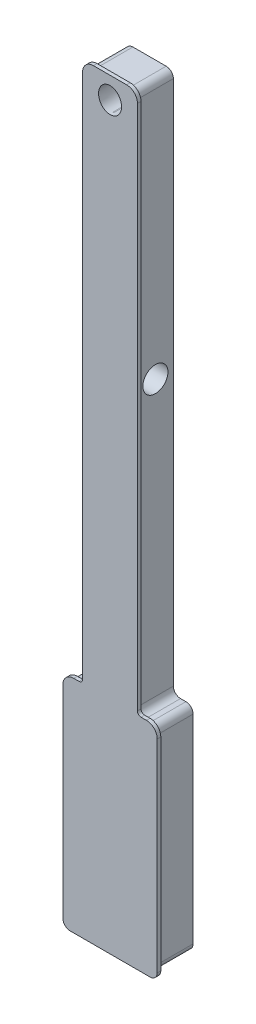
from build123d import *
from build123d.topology import SkipClean

# Parameters (mm, degrees)
BOSS_EXTRU_1_DEPTH       = 10
ESQUISSE2_RX             = 3.5
ESQUISSE2_RY             = 3
ENL_V_MAT_EXTRU_1_DEPTH  = 10
ESQUISSE3_R              = 3.2
ENL_V_MAT_EXTRU_2_DEPTH  = 10
ESQUISSE4_R              = 3.5
ENL_V_MAT_EXTRU_3_DEPTH  = 30
ESQUISSE5_W              = 26.27
ESQUISSE5_H              = 212
BOSS_EXTRU_2_DEPTH       = 1
CONG_1_R                 = 2
ENL_V_MAT_EXTRU_4_DEPTH  = 1
CONG_4_R                 = 2
ENL_V_START              = -15
ESQUISSE10_R             = 3.2
ENL_V_MAT_EXTRU_9_DEPTH  = 15
ESQUISSE11_RX            = 3.499824303
ESQUISSE11_RY            = 3.2
ENL_V_MAT_EXTRU_10_DEPTH = 15


with BuildPart() as part:
    # Esquisse1 → Boss.-Extru.1 (new body)
    with BuildSketch(Plane.XY):
        Polygon((-28.747990112, 301.570444422), (-28.747990112, 373.570444422), (-15.477990112, 373.570444422), (-15.477990112, 301.570444422), (-15.477990112, 223.567147766), (-15.477990112, 223.004578109), (-9.977990112, 223.004578109), (-9.977990112, 163.570444422), (-34.247990112, 163.570444422), (-34.247990112, 223.004578109), (-28.747990112, 223.004578109), align=None)
    extrude(amount=BOSS_EXTRU_1_DEPTH)

    # Esquisse2 → Enlèv. mat.-Extru.1 (cut)
    with BuildSketch(Plane.XY.offset(10)):
        with Locations(Location((-22.112990112, 368.570444422), (0, 0, 90))):
            Ellipse(ESQUISSE2_RX, ESQUISSE2_RY)
    extrude(amount=-ENL_V_MAT_EXTRU_1_DEPTH, mode=Mode.SUBTRACT)

    # Esquisse3 → Enlèv. mat.-Extru.2 (cut)
    with BuildSketch(Plane.XY.offset(10)):
        with Locations((-22.112990112, 368.570444422)):
            Circle(ESQUISSE3_R)
    extrude(amount=-ENL_V_MAT_EXTRU_2_DEPTH, mode=Mode.SUBTRACT)

    # Esquisse4 → Enlèv. mat.-Extru.3 (cut)
    with BuildSketch(Plane(origin=(-15.477990112, 0, 0), x_dir=(0, 0, -1), z_dir=(1, 0, 0))):
        with Locations((-5, 301.570444422)):
            Circle(ESQUISSE4_R)
    extrude(amount=-ENL_V_MAT_EXTRU_3_DEPTH, mode=Mode.SUBTRACT)

    # Esquisse5 → Boss.-Extru.2 (add)
    with BuildSketch(Plane.XY.offset(10)):
        with Locations((-22.112990112, 268.570444422)):
            Rectangle(ESQUISSE5_W, ESQUISSE5_H)
    extrude(amount=BOSS_EXTRU_2_DEPTH)

    # Congé1
    cong_1_edges = [part.edges().sort_by_distance(p)[0] for p in [
        (-15.477990112, 223.004578109, 5),
        (-15.477990112, 373.570444422, 5),
        (-28.747990112, 373.570444422, 5),
        (-28.747990112, 223.004578109, 5),
        (-34.247990112, 223.004578109, 5),
        (-34.247990112, 163.570444422, 5),
        (-9.977990112, 163.570444422, 5),
        (-9.977990112, 223.004578109, 5),
    ]]
    fillet(cong_1_edges, radius=CONG_1_R)

    # Esquisse6 → Enlèv. mat.-Extru.4 (cut)
    with BuildSketch(Plane(origin=(0, 0, 10), x_dir=(-1, 0, 0), z_dir=(0, 0, -1))):
        with BuildLine():
            ThreePointArc((8.977990112, 221.004578109), (9.856669769, 223.125898452), (11.977990112, 224.004578109))
            Line((11.977990112, 224.004578109), (13.477990112, 224.004578109))
            ThreePointArc((13.477990112, 224.004578109), (14.185096893, 224.297471327), (14.477990112, 225.004578109))
            Line((14.477990112, 225.004578109), (14.477990112, 371.570444422))
            ThreePointArc((14.477990112, 371.570444422), (15.356669769, 373.691764765), (17.477990112, 374.570444422))
            Line((17.477990112, 374.570444422), (17.477990112, 374.984122624))
            Line((17.477990112, 374.984122624), (8.965587761, 374.984122624))
            Line((8.965587761, 374.984122624), (8.965587761, 221.004578109))
            Line((8.965587761, 221.004578109), (8.977990112, 221.004578109))
        make_face()
        with BuildLine():
            Line((30.747990112, 224.004578109), (32.247990112, 224.004578109))
            ThreePointArc((32.247990112, 224.004578109), (34.369310456, 223.125898452), (35.247990112, 221.004578109))
            Line((35.247990112, 221.004578109), (36.747990112, 374.57051247))
            Line((36.747990112, 374.57051247), (26.747990112, 374.570444422))
            ThreePointArc((26.747990112, 374.570444422), (28.869310456, 373.691764765), (29.747990112, 371.570444422))
            Line((29.747990112, 371.570444422), (29.747990112, 225.004578109))
            ThreePointArc((29.747990112, 225.004578109), (30.040883331, 224.297471327), (30.747990112, 224.004578109))
        make_face()
    extrude(amount=-ENL_V_MAT_EXTRU_4_DEPTH, mode=Mode.SUBTRACT)

    # Congé4
    cong_4_edges = [part.edges().sort_by_distance(p)[0] for p in [
        (-35.247990112, 162.570444422, 10.5),
        (-8.977990112, 162.570444422, 10.5),
    ]]
    fillet(cong_4_edges, radius=CONG_4_R)

    # Esquisse10 → Enlèv. mat.-Extru.9 (cut)
    with SkipClean():  # the faces are left unmerged after this step: merging them gives an invalid solid
        with BuildSketch(Plane(origin=(0, 0, 0), x_dir=(-1, 0, 0), z_dir=(0, 0, -1)).offset(ENL_V_START)):
            with Locations(Location((22.112990112, 368.570444422, 0), (0, 0, 222.50046931))):
                Circle(ESQUISSE10_R)
        extrude(amount=ENL_V_MAT_EXTRU_9_DEPTH, mode=Mode.SUBTRACT)

    # Esquisse11 → Enlèv. mat.-Extru.10 (cut)
    with SkipClean():  # the faces are left unmerged after this step: merging them gives an invalid solid
        with BuildSketch(Plane(origin=(0, 0, 0), x_dir=(-1, 0, 0), z_dir=(0, 0, -1))):
            with Locations(Location((22.112990112, 368.570444422), (0, 0, 89.044564844))):
                Ellipse(ESQUISSE11_RX, ESQUISSE11_RY)
        extrude(amount=-ENL_V_MAT_EXTRU_10_DEPTH, mode=Mode.SUBTRACT)


solid = part.part
